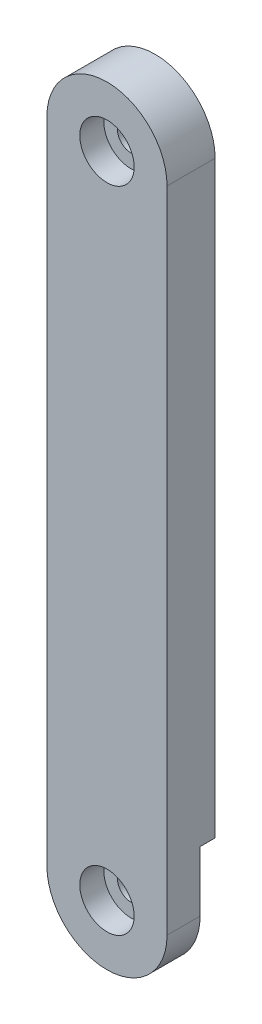
from build123d import *

# Parameters (mm, degrees)
SKETCH1_R           = 2.25
BOSS_EXTRUDE1_DEPTH = 8
SKETCH2_R           = 4.525
CUT_EXTRUDE1_DEPTH  = 4
CUT_EXTRUDE2_DEPTH  = 2.5


with BuildPart() as part:
    # Sketch1 → Boss-Extrude1 (new body)
    with BuildSketch(Plane.XY):
        with BuildLine():
            Line((10, 0), (10, 108))
            ThreePointArc((10, 108), (0, 118), (-10, 108))
            Line((-10, 108), (-10, 0))
            ThreePointArc((-10, 0), (0, -10), (10, 0))
        make_face()
        Circle(SKETCH1_R, mode=Mode.SUBTRACT)
        with Locations((0, 108)):
            Circle(SKETCH1_R, mode=Mode.SUBTRACT)
    extrude(amount=BOSS_EXTRUDE1_DEPTH)

    # Sketch2 → Cut-Extrude1 (cut)
    with BuildSketch(Plane.XY.offset(8)):
        Circle(SKETCH2_R)
        with Locations((0, 108)):
            Circle(SKETCH2_R)
    extrude(amount=-CUT_EXTRUDE1_DEPTH, mode=Mode.SUBTRACT)

    # Sketch3 → Cut-Extrude2 (cut)
    with BuildSketch(Plane.XY):
        with BuildLine():
            Line((7.5, 12), (7.5, 96))
            ThreePointArc((7.5, 96), (0, 93.849028302), (-7.5, 96))
            Line((-7.5, 96), (-7.5, 12))
            ThreePointArc((-7.5, 12), (0, -14.150971698), (7.5, 12))
        make_face()
    extrude(amount=CUT_EXTRUDE2_DEPTH, mode=Mode.SUBTRACT)


solid = part.part
